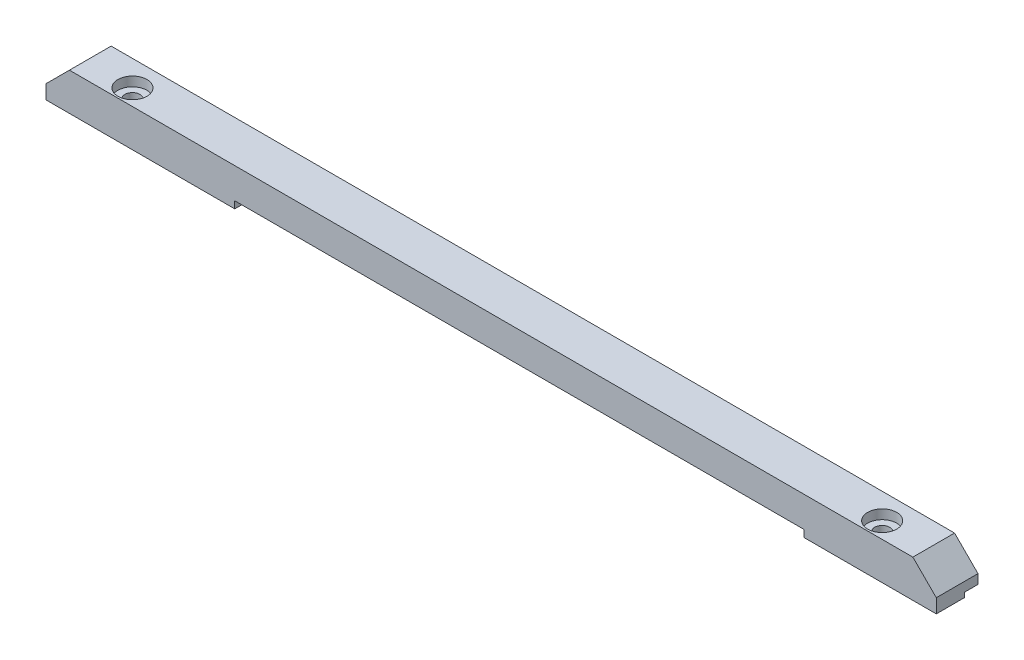
from build123d import *

# Parameters (mm, degrees)
SKETCH_1_W              = 337.35
SKETCH_1_H              = 116.87
SKETCH_1_W_2            = 324.05
SKETCH_1_H_2            = 103.07
EXTRUDE_1_DEPTH         = 8
FILLET_1_R              = 5
HOLE_WIZARD_3_2_3_2_1_D = 3.2
SKETCH_5_W              = 32
SKETCH_5_H              = 1.5
CUT_EXTRUDE_1_DEPTH     = 355.911853
EXTRUDE_2_REACH         = 356.912
SKETCH_6_W              = 3
SKETCH_6_H              = 8
SKETCH_7_W              = 257.05
SKETCH_7_H              = 8
EXTRUDE_3_DEPTH         = 4
SKETCH_8_W              = 257.05
SKETCH_8_H              = 4
EXTRUDE_4_DEPTH         = 3
SKETCH_11_W             = 99.07
SKETCH_11_H             = 11
EXTRUDE_5_DEPTH         = 2
SKETCH_13_W             = 42
SKETCH_13_H             = 4.5
CUT_EXTRUDE_2_DEPTH     = 354.692894189
SKETCH_14_W             = 121.5
SKETCH_14_H             = 1.5
CUT_EXTRUDE_3_DEPTH     = 355.911853
SKETCH_16_W             = 32
SKETCH_16_H             = 6.5
EXTRUDE_7_DEPTH         = 4
SKETCH_17_W             = 103.07
SKETCH_17_H             = 3
CUT_EXTRUDE_4_DEPTH     = 0.1
EXTRUDE_8_DEPTH         = 2
SKETCH_19_W             = 70.55
SKETCH_19_H             = 2
SKETCH_19_W_2           = 95
EXTRUDE_9_DEPTH         = 3
SKETCH_20_R             = 3.5
CUT_EXTRUDE_5_DEPTH     = 4
SKETCH_21_R             = 3.1
CUT_EXTRUDE_6_DEPTH     = 2
EXTRUDE_10_DEPTH        = 2
EXTRUDE_10_DEPTH_BACK   = 3
SKETCH_22_W             = 6
SKETCH_22_H             = 6
SKETCH_22_R             = 1.5
SKETCH_23_W             = 10
SKETCH_23_H             = 1.5
SKETCH_23_W_2           = 15
CUT_EXTRUDE_7_DEPTH     = 6.9
SKETCH_24_W             = 103.07
SKETCH_24_H             = 3
CUT_EXTRUDE_8_DEPTH     = 358.110094229
SKETCH_25_W             = 402.768513644
SKETCH_25_H             = 192.082702388
SKETCH_25_W_2           = 190
SKETCH_25_H_2           = 48.964424343
CUT_EXTRUDE_9_DEPTH     = 358.110094229
CHAMFER_1_SIZE          = 5


with BuildPart() as part:
    # 草图1 → 凸台-拉伸1 (new body)
    with BuildSketch(Plane(origin=(0, 0, 0), x_dir=(1, 0, 0), z_dir=(0, 1, 0))):
        with Locations((168.675, 58.435)):
            Rectangle(SKETCH_1_W, SKETCH_1_H)
        with Locations((168.925, 58.435)):
            Rectangle(SKETCH_1_W_2, SKETCH_1_H_2, mode=Mode.SUBTRACT)
    extrude(amount=EXTRUDE_1_DEPTH)

    # 圆角1
    fillet_1_edges = [part.edges().sort_by_distance(p)[0] for p in [
        (0, 4, -116.87),
        (337.35, 4, -116.87),
        (337.35, 4, 0),
        (0, 4, 0),
    ]]
    fillet(fillet_1_edges, radius=FILLET_1_R)

    # Ø3.2 (3.2) 直径孔1 (through all)
    with Locations(Plane(origin=(0, 8, 0), x_dir=(1, 0, 0), z_dir=(0, 1, 0))):
        with Locations((3.45, 98.435), (87.17, 113.42), (247.17, 113.42), (334.15, 98.435), (334.15, 18.435), (247.17, 3.45), (87.17, 3.45), (3.45, 18.435)):
            Hole(HOLE_WIZARD_3_2_3_2_1_D / 2)

    # 草图5 → 切除-拉伸1 (cut, through all)
    with BuildSketch(Plane.XY.offset(-109.97)):
        with Locations((57.9, 0.75)):
            Rectangle(SKETCH_5_W, SKETCH_5_H)
    extrude(amount=-CUT_EXTRUDE_1_DEPTH, mode=Mode.SUBTRACT)

    # 草图6 → 凸台-拉伸2 (add, up to next)
    with BuildSketch(Plane.XY.offset(-109.97), mode=Mode.PRIVATE) as extrude_2_sk1:
        with Locations((40.4, 4)):
            Rectangle(SKETCH_6_W, SKETCH_6_H)
    extrude_2_tool1 = extrude(extrude_2_sk1.sketch, amount=EXTRUDE_2_REACH, mode=Mode.PRIVATE) - part.part
    add(extrude_2_tool1.solids().sort_by_distance((40.4, 4, -109.97))[0])

    # 草图7 → 凸台-拉伸3 (add)
    with BuildSketch(Plane.XY.offset(-109.97)):
        with Locations((202.425, 4)):
            Rectangle(SKETCH_7_W, SKETCH_7_H)
    extrude(amount=EXTRUDE_3_DEPTH)

    # 草图8 → 凸台-拉伸4 (add)
    with BuildSketch(Plane.XZ):
        with Locations((202.425, -107.97)):
            Rectangle(SKETCH_8_W, SKETCH_8_H)
    extrude(amount=EXTRUDE_4_DEPTH)

    # 草图11 → 凸台-拉伸5 (add)
    with BuildSketch(Plane.ZY.offset(-330.95)):
        with Locations((-56.435, 2.5)):
            Rectangle(SKETCH_11_W, SKETCH_11_H)
    extrude(amount=EXTRUDE_5_DEPTH)

    # 草图13 → 切除-拉伸2 (cut, through all)
    with BuildSketch(Plane.XY.offset(-105.97)):
        with Locations((307.95, -0.75)):
            Rectangle(SKETCH_13_W, SKETCH_13_H)
    extrude(amount=-CUT_EXTRUDE_2_DEPTH, mode=Mode.SUBTRACT)

    # 草图14 → 切除-拉伸3 (cut, through all)
    with BuildSketch(Plane(origin=(0, 0, -6.9), x_dir=(-1, 0, 0), z_dir=(0, 0, -1))):
        with Locations((-173.2, 0.75)):
            Rectangle(SKETCH_14_W, SKETCH_14_H)
    extrude(amount=-CUT_EXTRUDE_3_DEPTH, mode=Mode.SUBTRACT)

    # 草图16 → 凸台-拉伸7 (add)
    with BuildSketch(Plane.XY.offset(-109.97)):
        with Locations((57.9, 4.75)):
            Rectangle(SKETCH_16_W, SKETCH_16_H)
    extrude(amount=EXTRUDE_7_DEPTH)

    # 草图17 → 切除-拉伸4 (cut)
    with BuildSketch(Plane(origin=(330.95, 0, 0), x_dir=(0, 0, -1), z_dir=(1, 0, 0))):
        with Locations((58.435, -1.5)):
            Rectangle(SKETCH_17_W, SKETCH_17_H)
    extrude(amount=-CUT_EXTRUDE_4_DEPTH, mode=Mode.SUBTRACT)

    # 草图18 → 凸台-拉伸8 (add)
    with BuildSketch(Plane(origin=(0, 0, -6.9), x_dir=(-1, 0, 0), z_dir=(0, 0, -1))):
        Polygon((-233.95, 0), (-233.95, 1.5), (-112.45, 1.5), (-112.45, 0), (-41.9, 0), (-41.9, 8), (-328.95, 8), (-328.95, 0), align=None)
    extrude(amount=EXTRUDE_8_DEPTH)

    # 草图19 → 凸台-拉伸9 (add)
    with BuildSketch(Plane.XZ):
        with Locations((77.175, -7.9)):
            Rectangle(SKETCH_19_W, SKETCH_19_H)
        with Locations((281.45, -7.9)):
            Rectangle(SKETCH_19_W_2, SKETCH_19_H)
    extrude(amount=EXTRUDE_9_DEPTH)

    # 草图20 → 切除-拉伸5 (cut)
    with BuildSketch(Plane.XZ.offset(3)):
        with Locations((92.088456012, -9.54)):
            Circle(SKETCH_20_R)
        with Locations((262.268456012, -9.54)):
            Circle(SKETCH_20_R)
        with Locations((328.308456012, -13.35)):
            Circle(SKETCH_20_R)
        with Locations((328.308456012, -74.31)):
            Circle(SKETCH_20_R)
        with Locations((137.808456012, -107.33)):
            Circle(SKETCH_20_R)
        with Locations((22.238456012, -9.54)):
            Circle(SKETCH_20_R)
        with Locations((9.538456012, -23.51)):
            Circle(SKETCH_20_R)
        with Locations((9.538456012, -103.52)):
            Circle(SKETCH_20_R)
    extrude(amount=-CUT_EXTRUDE_5_DEPTH, mode=Mode.SUBTRACT)

    # 草图21 → 切除-拉伸6 (cut)
    with BuildSketch(Plane(origin=(0, 8, 0), x_dir=(1, 0, 0), z_dir=(0, 1, 0))):
        with Locations(Location((87.17, 113.42, 0), (0, 0, 270))):
            Circle(SKETCH_21_R)
        with Locations(Location((247.17, 113.42, 0), (0, 0, 270))):
            Circle(SKETCH_21_R)
        with Locations(Location((334.15, 98.435, 0), (0, 0, 270))):
            Circle(SKETCH_21_R)
        with Locations(Location((334.15, 18.435, 0), (0, 0, 270))):
            Circle(SKETCH_21_R)
        with Locations(Location((247.17, 3.45, 0), (0, 0, 270))):
            Circle(SKETCH_21_R)
        with Locations(Location((87.17, 3.45, 0), (0, 0, 270))):
            Circle(SKETCH_21_R)
        with Locations(Location((3.45, 18.435, 0), (0, 0, 270))):
            Circle(SKETCH_21_R)
        with Locations(Location((3.45, 98.435, 0), (0, 0, 270))):
            Circle(SKETCH_21_R)
    extrude(amount=-CUT_EXTRUDE_6_DEPTH, mode=Mode.SUBTRACT)

    # 草图22 → 凸台-拉伸10 (add, two sides: drawn at the far end of the back side and taken through both)
    # profile 1 of 4: a face of its own
    with BuildSketch(Plane(origin=(0, 4, 0), x_dir=(1, 0, 0), z_dir=(0, 1, 0)).offset(-EXTRUDE_10_DEPTH_BACK)):
        with Locations((9.9, 106.97)):
            Rectangle(SKETCH_22_W, SKETCH_22_H)
        with Locations(Location((9.9, 106.97, 0), (0, 0, 90))):
            Circle(SKETCH_22_R, mode=Mode.SUBTRACT)
    # profile 2 of 4: a face of its own
    with BuildSketch(Plane(origin=(0, 4, 0), x_dir=(1, 0, 0), z_dir=(0, 1, 0)).offset(-EXTRUDE_10_DEPTH_BACK)):
        with Locations((35.9, 106.97)):
            Rectangle(SKETCH_22_W, SKETCH_22_H)
        with Locations(Location((35.9, 106.97, 0), (0, 0, 90))):
            Circle(SKETCH_22_R, mode=Mode.SUBTRACT)
    # profile 3 of 4: a face of its own
    with BuildSketch(Plane(origin=(0, 4, 0), x_dir=(1, 0, 0), z_dir=(0, 1, 0)).offset(-EXTRUDE_10_DEPTH_BACK)):
        with Locations((9.9, 9.9)):
            Rectangle(SKETCH_22_W, SKETCH_22_H)
        with Locations(Location((9.9, 9.9, 0), (0, 0, 90))):
            Circle(SKETCH_22_R, mode=Mode.SUBTRACT)
    # profile 4 of 4: a face of its own
    with BuildSketch(Plane(origin=(0, 4, 0), x_dir=(1, 0, 0), z_dir=(0, 1, 0)).offset(-EXTRUDE_10_DEPTH_BACK)):
        with Locations((35.9, 9.9)):
            Rectangle(SKETCH_22_W, SKETCH_22_H)
        with Locations(Location((35.9, 9.9, 0), (0, 0, 90))):
            Circle(SKETCH_22_R, mode=Mode.SUBTRACT)
    extrude(amount=EXTRUDE_10_DEPTH + EXTRUDE_10_DEPTH_BACK)

    # 草图23 → 切除-拉伸7 (cut)
    with BuildSketch(Plane.ZY):
        with Locations((-63.435, 0.75)):
            Rectangle(SKETCH_23_W, SKETCH_23_H)
        with Locations((-50.935, 0.75)):
            Rectangle(SKETCH_23_W_2, SKETCH_23_H)
    extrude(amount=-CUT_EXTRUDE_7_DEPTH, mode=Mode.SUBTRACT)

    # 草图24 → 切除-拉伸8 (cut, through all)
    with BuildSketch(Plane(origin=(337.35, 0, 0), x_dir=(0, 0, -1), z_dir=(1, 0, 0))):
        with Locations((58.435, -1.5)):
            Rectangle(SKETCH_24_W, SKETCH_24_H)
    extrude(amount=-CUT_EXTRUDE_8_DEPTH, mode=Mode.SUBTRACT)

    # 草图25 → 切除-拉伸9 (cut, through all)
    with BuildSketch(Plane(origin=(0, 8, 0), x_dir=(1, 0, 0), z_dir=(0, 1, 0))):
        with Locations((167.276381716, 50.966242561)):
            Rectangle(SKETCH_25_W, SKETCH_25_H)
        with Locations((167.17, 6.206921893)):
            Rectangle(SKETCH_25_W_2, SKETCH_25_H_2, mode=Mode.SUBTRACT)
    extrude(amount=-CUT_EXTRUDE_9_DEPTH, mode=Mode.SUBTRACT)

    # 倒角1
    chamfer_1_edges = [part.edges().sort_by_distance(p)[0] for p in [
        (72.17, 8, -4.45),
        (262.17, 8, -4.45),
    ]]
    chamfer(chamfer_1_edges, length=CHAMFER_1_SIZE)


solid = part.part
